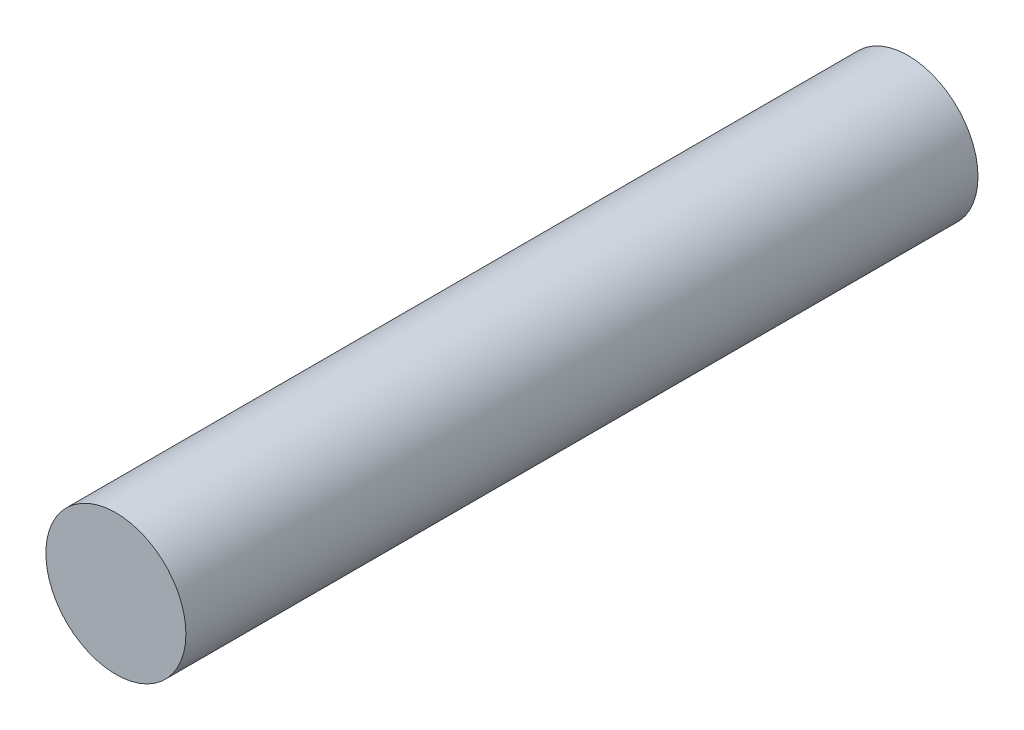
from build123d import *

# Parameters (mm, degrees)
SKETCH1_R           = 3
BOSS_EXTRUDE1_DEPTH = 33.93948


with BuildPart() as part:
    # Sketch1 → Boss-Extrude1 (new body)
    with BuildSketch(Plane.XY):
        Circle(SKETCH1_R)
    extrude(amount=BOSS_EXTRUDE1_DEPTH)


solid = part.part
